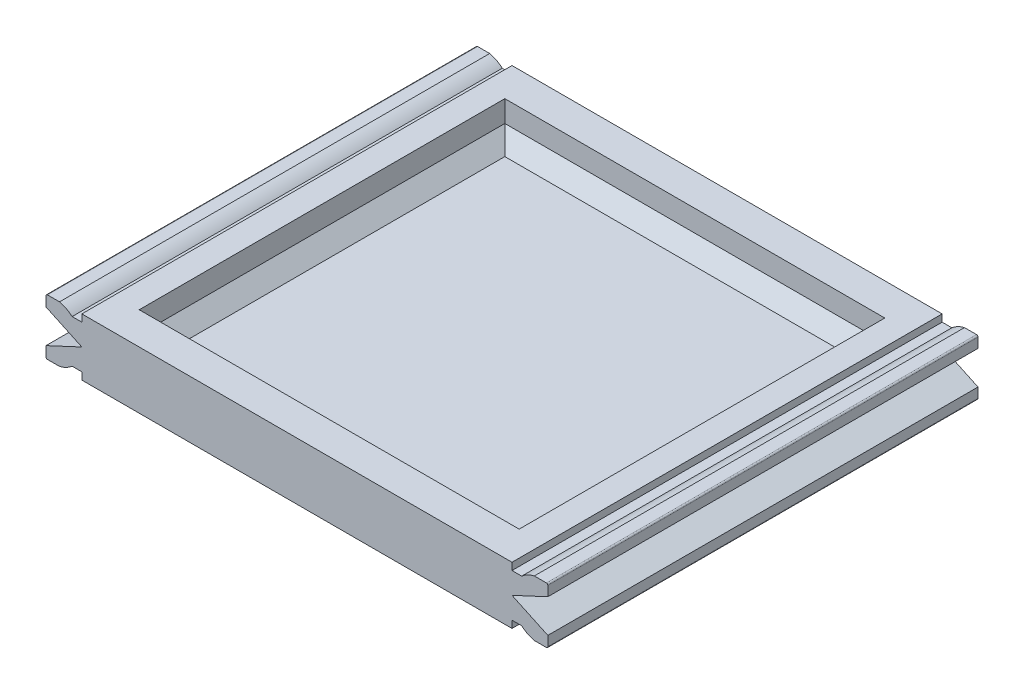
from build123d import *

# Parameters (mm, degrees)
EXTRUDE_1_DEPTH       = 2
EXTRUDE_1_DEPTH_BACK  = 2
SKETCH_1_W            = 30
SKETCH_1_H            = 30
SKETCH_2_W            = 26.5
SKETCH_2_H            = 25.5
CUT_EXTRUDE_1_DEPTH   = 2.5
CHAMFER_1_SIZE        = 1
EXTRUDE_2_DEPTH       = 15
MIRROR_2_COPY_1_DEPTH = 15
FILLET_1_R            = 0.1


with BuildPart() as part:
    # 草图1 → 凸台-拉伸1 (new, two sides: drawn at the far end of the back side and taken through both)
    with BuildSketch(Plane(origin=(0, 0, 0), x_dir=(1, 0, 0), z_dir=(0, 1, 0)).offset(-EXTRUDE_1_DEPTH_BACK)):
        Rectangle(SKETCH_1_W, SKETCH_1_H)
    extrude(amount=EXTRUDE_1_DEPTH + EXTRUDE_1_DEPTH_BACK)

    # 草图2 → 切除-拉伸1 (cut)
    with BuildSketch(Plane(origin=(0, 2, 0), x_dir=(1, 0, 0), z_dir=(0, 1, 0))):
        Rectangle(SKETCH_2_W, SKETCH_2_H)
    extrude(amount=-CUT_EXTRUDE_1_DEPTH, mode=Mode.SUBTRACT)

    # 倒角1
    chamfer_1_edges = [part.edges().sort_by_distance(p)[0] for p in [
        (13.25, -0.5, 0),
        (0, -0.5, 12.75),
        (-13.25, -0.5, 0),
        (0, -0.5, -12.75),
    ]]
    chamfer(chamfer_1_edges, length=CHAMFER_1_SIZE)

    # 草图3 → 凸台-拉伸2 (add, symmetric)
    with BuildSketch(Plane.XY):
        with BuildLine():
            Line((15.677124344, 1.5), (15, 1.5))
            Line((15, 1.5), (15, 0))
            Line((15, 0), (17.5, 1.165769145))
            Line((17.5, 1.165769145), (17.5, 1.95))
            Line((17.5, 1.95), (16.555590279, 1.95))
            ThreePointArc((16.555590279, 1.95), (16.088161527, 1.780042303), (15.677124344, 1.5))
        make_face()
    extrude_2 = extrude(amount=EXTRUDE_2_DEPTH, both=True)

    # 镜向1: 凸台-拉伸2 across plane
    add(extrude_2.mirror(Plane.ZX))

    # 镜向2: 凸台-拉伸2 across plane
    add(extrude_2.mirror(Plane(origin=(0, 0, 0), x_dir=(0, 0, 1), z_dir=(1, 0, 0))))

    # 镜向2 copy 1 sketch → 镜向2 copy 1 (add, symmetric)
    with BuildSketch(Plane(origin=(0, 0, 0), x_dir=(-1, 0, 0), z_dir=(0, 0, 1))):
        with BuildLine():
            Line((15.677124344, 1.5), (15, 1.5))
            Line((15, 1.5), (15, 0))
            Line((15, 0), (17.5, 1.165769145))
            Line((17.5, 1.165769145), (17.5, 1.95))
            Line((17.5, 1.95), (16.555590279, 1.95))
            ThreePointArc((16.555590279, 1.95), (16.088161527, 1.780042303), (15.677124344, 1.5))
        make_face()
    extrude(amount=MIRROR_2_COPY_1_DEPTH, both=True)

    # 圆角1
    fillet_1_edges = [part.edges().sort_by_distance(p)[0] for p in [
        (17.5, -1.95, 0),
        (17.5, 1.95, 0),
        (-17.5, -1.95, 0),
        (-17.5, 1.95, 0),
    ]]
    fillet(fillet_1_edges, radius=FILLET_1_R)


solid = part.part
